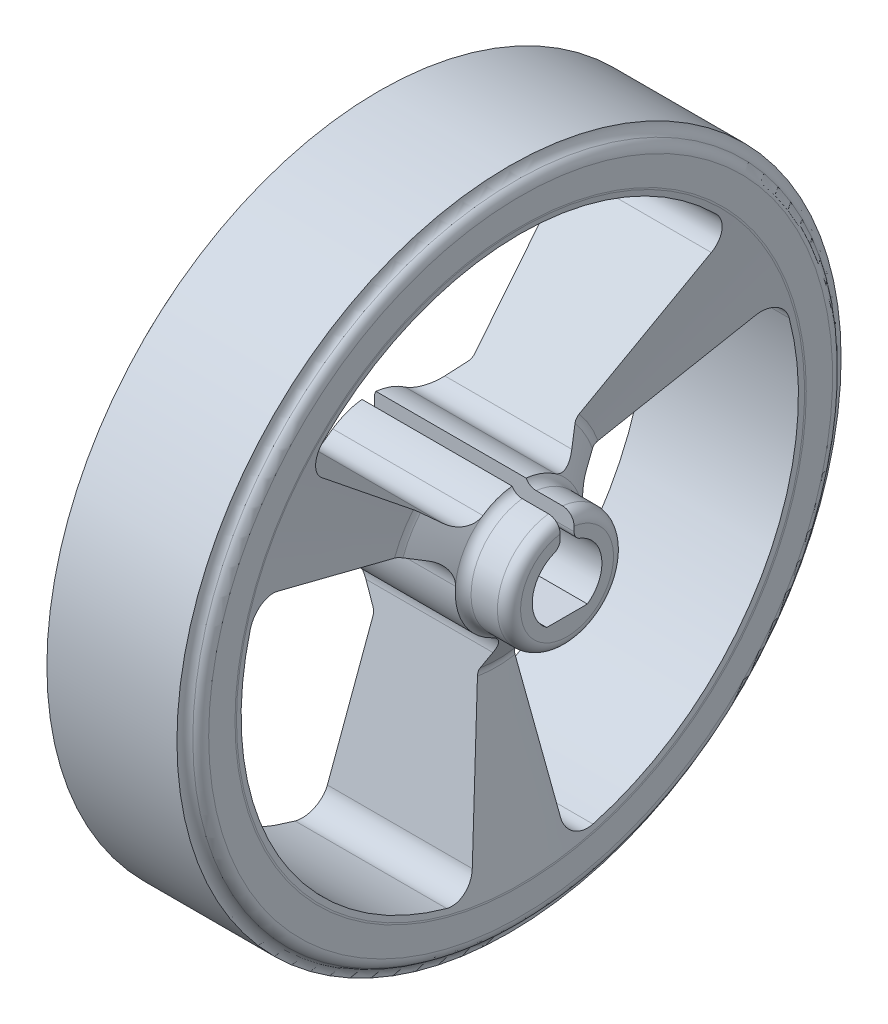
from build123d import *

# Parameters (mm, degrees)
CUT_EXTRUDE2_DEPTH = 22.975895886
CIRPATTERN1_COUNT  = 3
CUT_EXTRUDE3_DEPTH = 22.975895886
SCALE1_SCALE       = 4


with BuildPart() as part:
    # Sketch1 → Revolve1 (revolve)
    with BuildSketch(Plane(origin=(0, 0, 0), x_dir=(1, 0, 0), z_dir=(0, 1, 0)), mode=Mode.PRIVATE) as revolve1_sk:
        with BuildLine():
            Line((0, 0), (0, 2.5))
            ThreePointArc((0, 2.5), (0.017037087, 2.629409523), (0.066987298, 2.75))
            Line((0.066987298, 2.75), (0.98771433, 4.344746))
            ThreePointArc((0.98771433, 4.344746), (1.045401255, 4.498757059), (1.05, 4.663153041))
            Line((1.05, 4.663153041), (0.004701629, 12.231592959))
            ThreePointArc((0.004701629, 12.231592959), (0.001176792, 12.265715789), (0, 12.3))
            Line((0, 12.3), (0, 13.433974596))
            ThreePointArc((0, 13.433974596), (0.066987298, 13.683974596), (0.25, 13.866987298))
            ThreePointArc((0.25, 13.866987298), (0.433012702, 14.05), (0.5, 14.3))
            Line((0.5, 14.3), (6.1, 14.3))
            ThreePointArc((6.1, 14.3), (6.166987298, 14.05), (6.35, 13.866987298))
            ThreePointArc((6.35, 13.866987298), (6.533012702, 13.683974596), (6.6, 13.433974596))
            Line((6.6, 13.433974596), (6.6, 12.3))
            ThreePointArc((6.6, 12.3), (6.598823208, 12.265715789), (6.595298371, 12.231592959))
            Line((6.595298371, 12.231592959), (5.55, 4.663153041))
            ThreePointArc((5.55, 4.663153041), (5.554598745, 4.498757059), (5.61228567, 4.344746))
            Line((5.61228567, 4.344746), (6.533012702, 2.75))
            ThreePointArc((6.533012702, 2.75), (6.716025404, 2.566987298), (6.966025404, 2.5))
            Line((6.966025404, 2.5), (8.1, 2.5))
            ThreePointArc((8.1, 2.5), (8.453553391, 2.353553391), (8.6, 2))
            Line((8.6, 2), (8.6, 0))
            Line((8.6, 0), (0, 0))
        make_face()
    revolve(revolve1_sk.sketch.rotate(Axis((0, 0, 0), (1, 0, 0)), 180), axis=Axis((0, 0, 0), (1, 0, 0)))

    # Sketch2 → Cut-Extrude2 (cut, symmetric)
    with BuildSketch(Plane(origin=(0, 0, 0), x_dir=(0, 0, -1), z_dir=(1, 0, 0))):
        with BuildLine():
            Line((8.391596431, 7.04138547), (2.768644011, 2.323168169))
            ThreePointArc((2.768644011, 2.323168169), (2.17353825, 2.090350038), (1.558961361, 2.265422582))
            ThreePointArc((1.558961361, 2.265422582), (0, 2.75), (-1.558961361, 2.265422582))
            ThreePointArc((-1.558961361, 2.265422582), (-2.17353825, 2.090350038), (-2.768644011, 2.323168169))
            Line((-2.768644011, 2.323168169), (-8.391596431, 7.04138547))
            ThreePointArc((-8.391596431, 7.04138547), (-8.747937455, 7.765692967), (-8.453245987, 8.517196269))
            ThreePointArc((-8.453245987, 8.517196269), (0, 12), (8.453245987, 8.517196269))
            ThreePointArc((8.453245987, 8.517196269), (8.747937455, 7.765692967), (8.391596431, 7.04138547))
        make_face()
    cut_extrude2 = extrude(amount=CUT_EXTRUDE2_DEPTH, both=True, mode=Mode.SUBTRACT)

    # CirPattern1: Cut-Extrude2 ×3 about axis
    cirpattern1_axis = Axis((0, 0, 0), (1, 0, 0))
    for i in range(1, CIRPATTERN1_COUNT):
        add(cut_extrude2.rotate(cirpattern1_axis, i * 360 / CIRPATTERN1_COUNT), mode=Mode.SUBTRACT)

    # Sketch3 → Cut-Extrude3 (cut, through all)
    with BuildSketch(Plane.ZY):
        with BuildLine():
            Line((0.875, -1.218349293), (-0.875, -1.218349293))
            ThreePointArc((-0.875, -1.218349293), (-1.48871199, 0.183675284), (-0.552631579, 1.394488558))
            ThreePointArc((-0.552631579, 1.394488558), (-0.369131923, 1.541571578), (-0.3, 1.766352173))
            Line((-0.3, 1.766352173), (-0.3, 2.733587387))
            ThreePointArc((-0.3, 2.733587387), (0, 2.75), (0.3, 2.733587387))
            Line((0.3, 2.733587387), (0.3, 1.766352173))
            ThreePointArc((0.3, 1.766352173), (0.369131923, 1.541571578), (0.552631579, 1.394488558))
            ThreePointArc((0.552631579, 1.394488558), (1.48871199, 0.183675284), (0.875, -1.218349293))
        make_face()
    extrude(amount=-CUT_EXTRUDE3_DEPTH, mode=Mode.SUBTRACT)


with BuildPart() as part_1:
    # Scale1: scaled about (3.358181092, -0.009699982, 3e-09)
    add(part.part.scale(SCALE1_SCALE).moved(Location((-10.074543276, 0.029099946, -9e-09))))


solid = part_1.part
